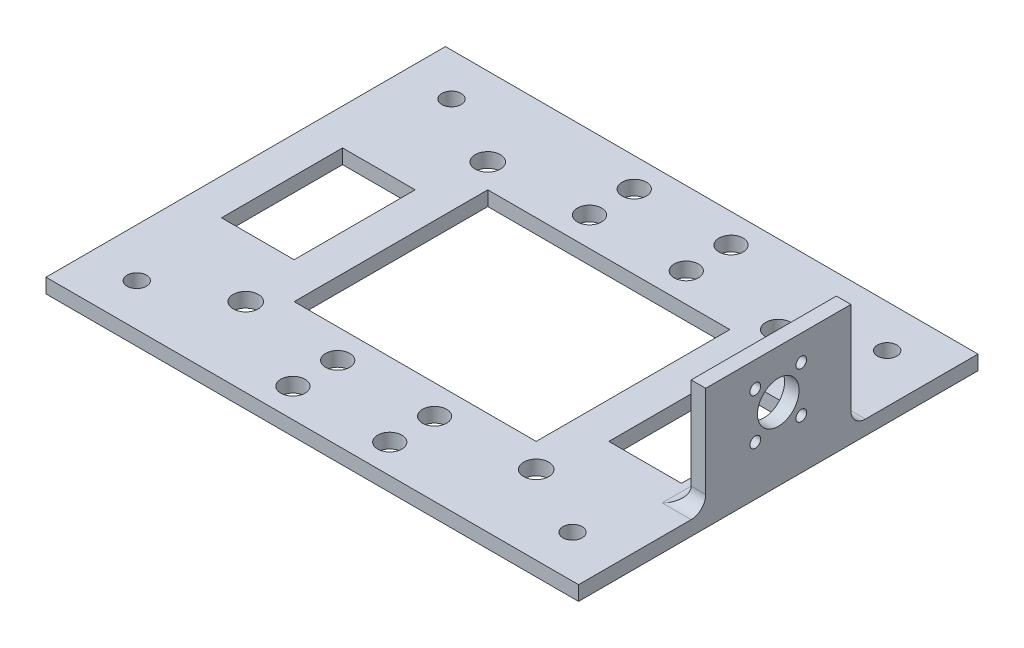
from build123d import *

# Parameters (mm, degrees)
BOSS_EXTRUDE1_DEPTH                           = 1.5
BOSS_EXTRUDE1_DEPTH_BACK                      = 1.5
SKETCH1_W                                     = 110
SKETCH1_H                                     = 82.5
SKETCH1_R                                     = 2
SKETCH1_R_2                                   = 2.6
SKETCH1_W_2                                   = 50
SKETCH1_H_2                                   = 40
SKETCH2_W                                     = 30
SKETCH2_H                                     = 25
SKETCH2_R                                     = 4.3
SKETCH2_R_2                                   = 1.1
BOSS_EXTRUDE2_DEPTH                           = 3
FILLET1_R                                     = 3
ZIP_TIE_HOLES_AND_WEIGHT_REDUCTION_DEPTH      = 73.655436823
ZIP_TIE_HOLES_AND_WEIGHT_REDUCTION_DEPTH_BACK = 73.655436823
SKETCH3_R                                     = 2.5
SKETCH3_W                                     = 15
SKETCH3_H                                     = 25


with BuildPart() as part:
    # Sketch1 → Boss-Extrude1 (new, two sides: drawn at the far end of the back side and taken through both)
    with BuildSketch(Plane(origin=(0, 0, 0), x_dir=(1, 0, 0), z_dir=(0, 1, 0)).offset(-BOSS_EXTRUDE1_DEPTH_BACK)):
        Rectangle(SKETCH1_W, SKETCH1_H)
        with Locations((45, 32.5)):
            Circle(SKETCH1_R, mode=Mode.SUBTRACT)
        with Locations((45, -32.5)):
            Circle(SKETCH1_R, mode=Mode.SUBTRACT)
        with Locations((-45, -32.5)):
            Circle(SKETCH1_R, mode=Mode.SUBTRACT)
        with Locations((-45, 32.5)):
            Circle(SKETCH1_R, mode=Mode.SUBTRACT)
        with Locations((-30, -25)):
            Circle(SKETCH1_R_2, mode=Mode.SUBTRACT)
        with Locations((30, -25)):
            Circle(SKETCH1_R_2, mode=Mode.SUBTRACT)
        with Locations((-30, 25)):
            Circle(SKETCH1_R_2, mode=Mode.SUBTRACT)
        with Locations((30, 25)):
            Circle(SKETCH1_R_2, mode=Mode.SUBTRACT)
        Rectangle(SKETCH1_W_2, SKETCH1_H_2, mode=Mode.SUBTRACT)
    extrude(amount=BOSS_EXTRUDE1_DEPTH + BOSS_EXTRUDE1_DEPTH_BACK)

    # Sketch2 → Boss-Extrude2 (add)
    with BuildSketch(Plane(origin=(55, 0, 0), x_dir=(0, 0, -1), z_dir=(1, 0, 0))):
        with Locations((0, 11)):
            Rectangle(SKETCH2_W, SKETCH2_H)
        with Locations((0, 13.5)):
            Circle(SKETCH2_R, mode=Mode.SUBTRACT)
        with Locations((-4.75, 18.25)):
            Circle(SKETCH2_R_2, mode=Mode.SUBTRACT)
        with Locations((4.75, 18.25)):
            Circle(SKETCH2_R_2, mode=Mode.SUBTRACT)
        with Locations((4.75, 8.75)):
            Circle(SKETCH2_R_2, mode=Mode.SUBTRACT)
        with Locations((-4.75, 8.75)):
            Circle(SKETCH2_R_2, mode=Mode.SUBTRACT)
    extrude(amount=-BOSS_EXTRUDE2_DEPTH)

    # Fillet1
    fillet1_edges = [part.edges().sort_by_distance(p)[0] for p in [
        (53.5, 1.5, 15),
        (53.5, 1.5, -15),
        (52, 1.5, 0),
    ]]
    fillet(fillet1_edges, radius=FILLET1_R)

    # Sketch3 → Zip tie holes and weight reduction (cut, two sides: drawn at the far end of the back side and taken through both)
    with BuildSketch(Plane(origin=(0, 0, 0), x_dir=(1, 0, 0), z_dir=(0, 1, 0)).offset(-ZIP_TIE_HOLES_AND_WEIGHT_REDUCTION_DEPTH_BACK)):
        with Locations((-10, -35.25)):
            Circle(SKETCH3_R)
        with Locations((-10, -26)):
            Circle(SKETCH3_R)
        with Locations((10, -26)):
            Circle(SKETCH3_R)
        with Locations((10, -35.25)):
            Circle(SKETCH3_R)
        with Locations((-10, 35.25)):
            Circle(SKETCH3_R)
        with Locations((-10, 26)):
            Circle(SKETCH3_R)
        with Locations((10, 26)):
            Circle(SKETCH3_R)
        with Locations((10, 35.25)):
            Circle(SKETCH3_R)
        with Locations((40, 0)):
            Rectangle(SKETCH3_W, SKETCH3_H)
        with Locations((-40, 0)):
            Rectangle(SKETCH3_W, SKETCH3_H)
    extrude(amount=ZIP_TIE_HOLES_AND_WEIGHT_REDUCTION_DEPTH + ZIP_TIE_HOLES_AND_WEIGHT_REDUCTION_DEPTH_BACK, mode=Mode.SUBTRACT)


solid = part.part
